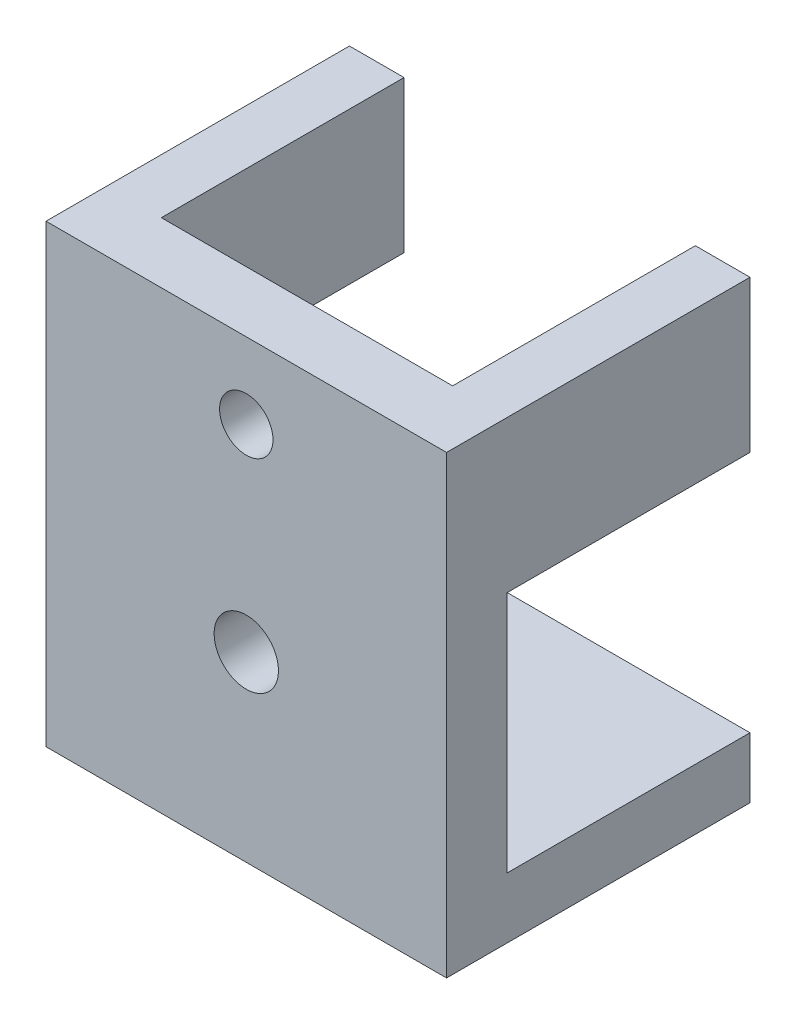
from build123d import *

# Parameters (mm, degrees)
SKETCH2_W           = 33
SKETCH2_H           = 37.5
BOSS_EXTRUDE1_DEPTH = 5
SKETCH3_W           = 33
SKETCH3_H           = 5
BOSS_EXTRUDE2_DEPTH = 20
SKETCH6_R           = 2.65
CUT_EXTRUDE2_DEPTH  = 10
SKETCH7_R           = 2.65
CUT_EXTRUDE3_DEPTH  = 10
SKETCH8_W           = 4.5
SKETCH8_H           = 12.5
BOSS_EXTRUDE3_DEPTH = 20
SKETCH9_R           = 2.2
CUT_EXTRUDE4_DEPTH  = 10


with BuildPart() as part:
    # Sketch2 → Boss-Extrude1 (new body)
    with BuildSketch(Plane.XY):
        with Locations((16.5, 18.75)):
            Rectangle(SKETCH2_W, SKETCH2_H)
    extrude(amount=BOSS_EXTRUDE1_DEPTH)

    # Sketch3 → Boss-Extrude2 (add)
    with BuildSketch(Plane.XY):
        with Locations((16.5, 2.5)):
            Rectangle(SKETCH3_W, SKETCH3_H)
    extrude(amount=-BOSS_EXTRUDE2_DEPTH)

    # Sketch6 → Cut-Extrude2 (cut)
    with BuildSketch(Plane.XZ):
        with Locations(Location((16.5, -10, 0), (0, 0, 270))):
            Circle(SKETCH6_R)
    extrude(amount=-CUT_EXTRUDE2_DEPTH, mode=Mode.SUBTRACT)

    # Sketch7 → Cut-Extrude3 (cut)
    with BuildSketch(Plane(origin=(0, 0, 0), x_dir=(-1, 0, 0), z_dir=(0, 0, -1))):
        with Locations((-16.5, 15)):
            Circle(SKETCH7_R)
    extrude(amount=-CUT_EXTRUDE3_DEPTH, mode=Mode.SUBTRACT)

    # Sketch8 → Boss-Extrude3 (add)
    with BuildSketch(Plane(origin=(0, 0, 0), x_dir=(-1, 0, 0), z_dir=(0, 0, -1))):
        with Locations((-30.75, 31.25)):
            Rectangle(SKETCH8_W, SKETCH8_H)
        with Locations((-2.25, 31.25)):
            Rectangle(SKETCH8_W, SKETCH8_H)
    extrude(amount=BOSS_EXTRUDE3_DEPTH)

    # Sketch9 → Cut-Extrude4 (cut)
    with BuildSketch(Plane.XY.offset(5)):
        with Locations((16.5, 31.25)):
            Circle(SKETCH9_R)
    extrude(amount=-CUT_EXTRUDE4_DEPTH, mode=Mode.SUBTRACT)


solid = part.part
